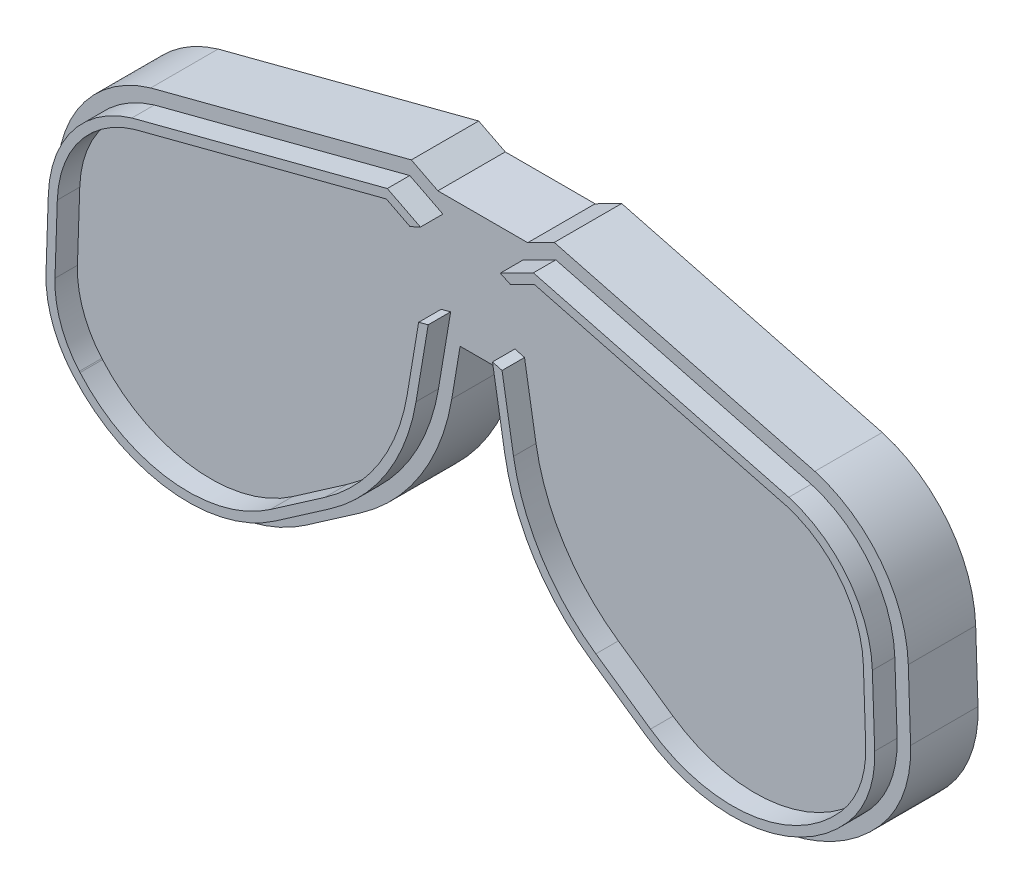
from build123d import *

# Parameters (mm, degrees)
BOSS_EXTRUDE4_DEPTH   = 12.7
BOSS_EXTRUDE4_2_DEPTH = 12.7
BOSS_EXTRUDE5_DEPTH   = 38.1


with BuildPart() as part:
    # Sketch2 → Boss-Extrude4 (new body)
    with BuildSketch(Plane.XY):
        with BuildLine():
            ThreePointArc((130.666228666, 106.040091995), (74.379304348, 92.172465986), (23.16792252, 119.337209155))
            Line((23.16792252, 119.337209155), (22.77315682, 119.78870897))
            ThreePointArc((22.77315682, 119.78870897), (12.204694496, 137.808335599), (8.992462879, 158.450062944))
            Line((8.992462879, 158.450062944), (10.303555993, 197.402864989))
            ThreePointArc((10.303555993, 197.402864989), (22.982521012, 232.613357646), (53.844679084, 253.780836152))
            Line((53.844679084, 253.780836152), (196.311281008, 290.94067285))
            Line((196.311281008, 290.94067285), (209.739641383, 284.113481114))
            Line((209.739641383, 284.113481114), (215.613399737, 286.826029602))
            Line((215.613399737, 286.826029602), (196.894837031, 296.342844243))
            Line((196.894837031, 296.342844243), (52.480544155, 258.674987582))
            ThreePointArc((52.480544155, 258.674987582), (18.98894665, 235.75335118), (5.226431104, 197.573753427))
            Line((5.226431104, 197.573753427), (3.91533799, 158.620951381))
            ThreePointArc((3.91533799, 158.620951381), (7.419590663, 136.102703369), (18.948822289, 116.444928865))
            Line((18.948822289, 116.444928865), (19.343587989, 115.99342905))
            ThreePointArc((19.343587989, 115.99342905), (73.755681182, 87.130889432), (133.560538269, 101.865242067))
            Line((133.560538269, 101.865242067), (164.448728673, 123.279182124))
            ThreePointArc((164.448728673, 123.279182124), (196.554033533, 156.731222664), (213.120538575, 200.036424744))
            Line((213.120538575, 200.036424744), (219.998210819, 241.179321991))
            Line((219.998210819, 241.179321991), (214.599432522, 239.69403431))
            Line((214.599432522, 239.69403431), (208.110063324, 200.874003253))
            ThreePointArc((208.110063324, 200.874003253), (192.26384111, 159.451636047), (161.55441907, 127.454032052))
            Line((161.55441907, 127.454032052), (130.666228666, 106.040091995))
        make_face()
    extrude(amount=BOSS_EXTRUDE4_DEPTH)


with BuildPart() as body_2:
    # Sketch2 → Boss-Extrude4 2 (new body)
    with BuildSketch(Plane.XY):
        with BuildLine():
            Line((268.255383959, 200.874003253), (261.766014761, 239.69403431))
            Line((261.766014761, 239.69403431), (256.367236464, 241.179321991))
            Line((256.367236464, 241.179321991), (263.244908708, 200.036424744))
            ThreePointArc((263.244908708, 200.036424744), (279.81141375, 156.731222664), (311.91671861, 123.279182124))
            Line((311.91671861, 123.279182124), (342.804909014, 101.865242067))
            ThreePointArc((342.804909014, 101.865242067), (402.609766101, 87.130889432), (457.021859294, 115.99342905))
            Line((457.021859294, 115.99342905), (457.416624994, 116.444928865))
            ThreePointArc((457.416624994, 116.444928865), (468.94585662, 136.102703369), (472.450109293, 158.620951381))
            Line((472.450109293, 158.620951381), (471.139016179, 197.573753427))
            ThreePointArc((471.139016179, 197.573753427), (457.376500633, 235.75335118), (423.884903128, 258.674987582))
            Line((423.884903128, 258.674987582), (279.470610252, 296.342844243))
            Line((279.470610252, 296.342844243), (260.752047545, 286.826029602))
            Line((260.752047545, 286.826029602), (266.6258059, 284.113481114))
            Line((266.6258059, 284.113481114), (280.054166275, 290.94067285))
            Line((280.054166275, 290.94067285), (422.520768199, 253.780836152))
            ThreePointArc((422.520768199, 253.780836152), (453.382926271, 232.613357646), (466.06189129, 197.402864989))
            Line((466.06189129, 197.402864989), (467.372984404, 158.450062944))
            ThreePointArc((467.372984404, 158.450062944), (464.160752787, 137.808335599), (453.592290463, 119.78870897))
            Line((453.592290463, 119.78870897), (453.197524763, 119.337209155))
            ThreePointArc((453.197524763, 119.337209155), (401.986142934, 92.172465986), (345.699218617, 106.040091995))
            Line((345.699218617, 106.040091995), (314.811028213, 127.454032052))
            ThreePointArc((314.811028213, 127.454032052), (284.101606173, 159.451636047), (268.255383959, 200.874003253))
        make_face()
    extrude(amount=BOSS_EXTRUDE4_2_DEPTH)


with BuildPart() as body_3:
    # Sketch2<7> → Boss-Extrude5 (new body)
    with BuildSketch(Plane.XY):
        with BuildLine():
            Line((13.212320492, 111.429258706), (13.607086192, 110.977758891))
            ThreePointArc((13.607086192, 110.977758891), (72.820246431, 79.568524602), (137.902002674, 95.602967174))
            Line((137.902002674, 95.602967174), (168.790193078, 117.016907231))
            ThreePointArc((168.790193078, 117.016907231), (202.989322168, 152.65060259), (220.636251451, 198.780056979))
            Line((220.636251451, 198.780056979), (225.352654567, 226.99403431))
            Line((225.352654567, 226.99403431), (251.012792715, 226.99403431))
            Line((251.012792715, 226.99403431), (255.729195832, 198.780056979))
            ThreePointArc((255.729195832, 198.780056979), (273.376125115, 152.65060259), (307.575254205, 117.016907231))
            Line((307.575254205, 117.016907231), (338.463444609, 95.602967174))
            ThreePointArc((338.463444609, 95.602967174), (403.545200852, 79.568524602), (462.758361091, 110.977758891))
            Line((462.758361091, 110.977758891), (463.153126791, 111.429258706))
            ThreePointArc((463.153126791, 111.429258706), (476.12351237, 133.544255024), (480.065796627, 158.877284038))
            Line((480.065796627, 158.877284038), (478.754703513, 197.830086083))
            ThreePointArc((478.754703513, 197.830086083), (463.365021319, 240.465642974), (425.925399797, 266.017702963))
            Line((425.925399797, 266.017702963), (278.595276217, 304.446101331))
            Line((278.595276217, 304.446101331), (263.582723641, 296.813481114))
            Line((263.582723641, 296.813481114), (212.782723641, 296.813481114))
            Line((212.782723641, 296.813481114), (197.770171066, 304.446101331))
            Line((197.770171066, 304.446101331), (50.440047486, 266.017702963))
            ThreePointArc((50.440047486, 266.017702963), (13.000425964, 240.465642974), (-2.38925623, 197.830086083))
            Line((-2.38925623, 197.830086083), (-3.700349344, 158.877284038))
            ThreePointArc((-3.700349344, 158.877284038), (0.241934913, 133.544255024), (13.212320492, 111.429258706))
        make_face()
    extrude(amount=-BOSS_EXTRUDE5_DEPTH)


solid = Compound([part.part, body_2.part, body_3.part])
